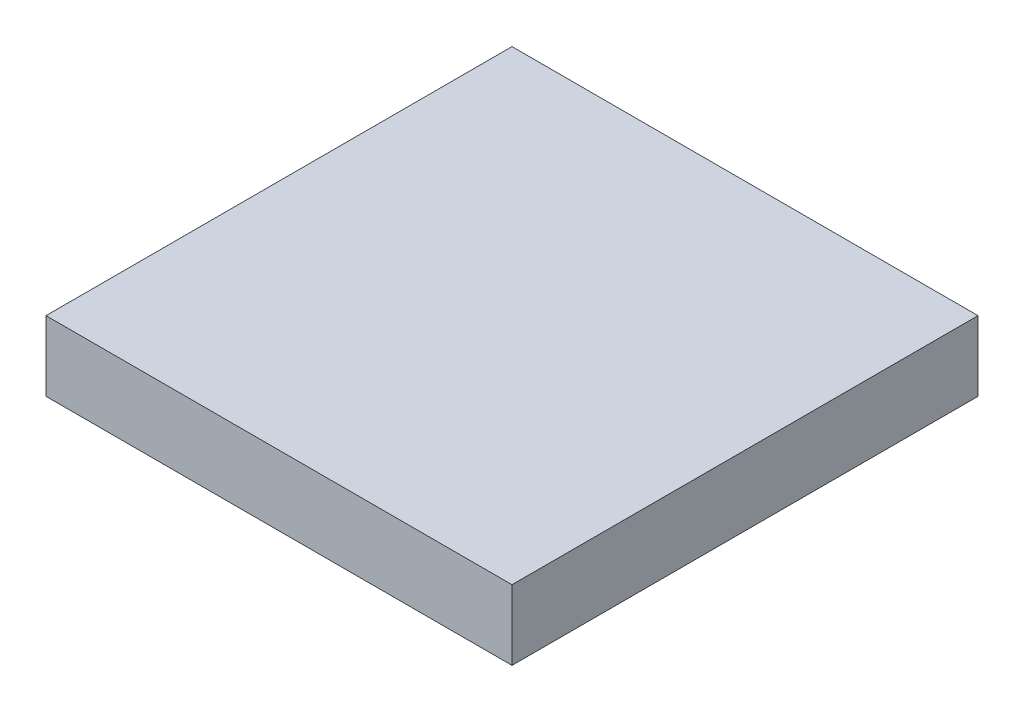
from build123d import *

# Parameters (mm, degrees)
SKETCH1_W           = 101.6
SKETCH1_H           = 101.6
BOSS_EXTRUDE1_DEPTH = 15.24
SKETCH2_R           = 2.413
CUT_EXTRUDE1_DEPTH  = 10.16


with BuildPart() as part:
    # Sketch1 → Boss-Extrude1 (new body)
    with BuildSketch(Plane(origin=(0, 0, 0), x_dir=(1, 0, 0), z_dir=(0, 1, 0))):
        with Locations((15.083959044, 23.232764505)):
            Rectangle(SKETCH1_W, SKETCH1_H)
    extrude(amount=BOSS_EXTRUDE1_DEPTH)

    # Sketch2 → Cut-Extrude1 (cut)
    with BuildSketch(Plane.XZ):
        with Locations(Location((15.083959044, -23.232764505, 0), (0, 0, 270))):
            Circle(SKETCH2_R)
    extrude(amount=-CUT_EXTRUDE1_DEPTH, mode=Mode.SUBTRACT)


solid = part.part
